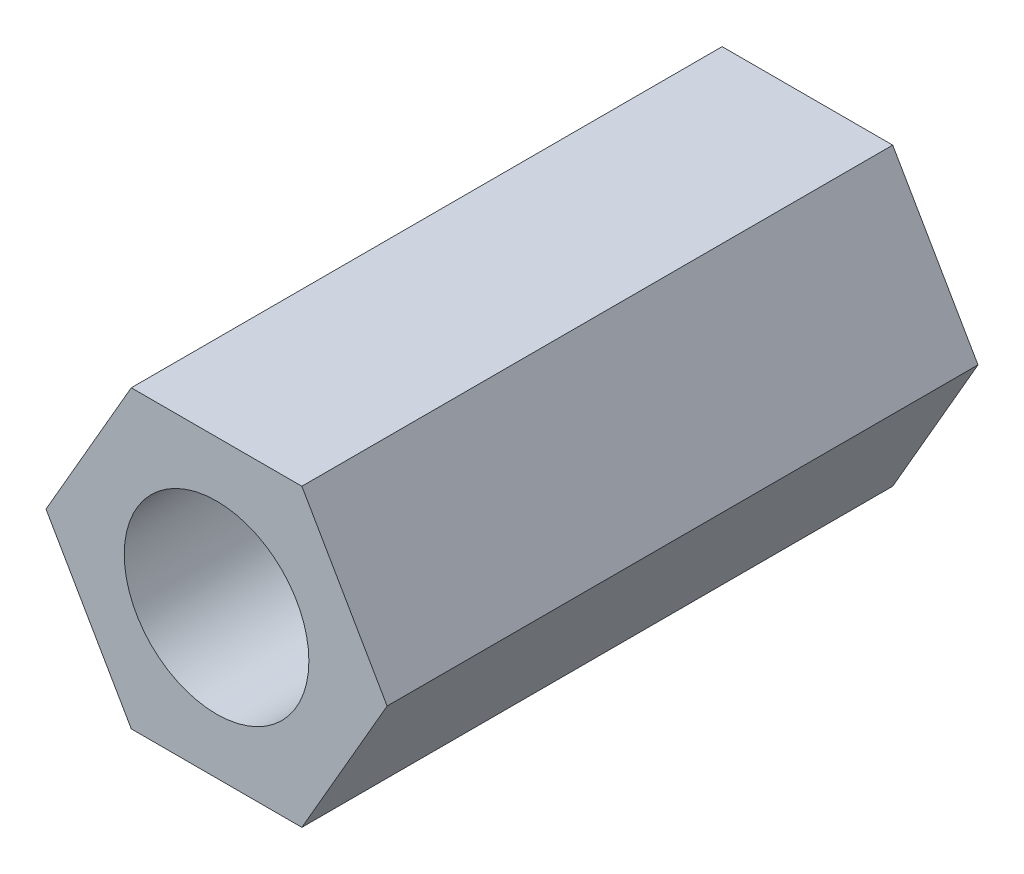
from build123d import *

# Parameters (mm, degrees)
BOSS_EXTRUDE1_DEPTH     = 8
CUT_EXTRUDE1_DEPTH      = 9.563488386
CUT_EXTRUDE1_DEPTH_BACK = 9.563488386
SKETCH2_R               = 1.25


with BuildPart() as part:
    # Sketch1 → Boss-Extrude1 (new body)
    with BuildSketch(Plane.XY):
        Polygon((2.309401077, 0), (1.154700538, 2), (-1.154700538, 2), (-2.309401077, 0), (-1.154700538, -2), (1.154700538, -2), align=None)
    extrude(amount=-BOSS_EXTRUDE1_DEPTH)

    # Sketch2 → Cut-Extrude1 (cut, two sides: drawn at the far end of the back side and taken through both)
    with BuildSketch(Plane.XY.offset(-CUT_EXTRUDE1_DEPTH_BACK)):
        Circle(SKETCH2_R)
    extrude(amount=CUT_EXTRUDE1_DEPTH + CUT_EXTRUDE1_DEPTH_BACK, mode=Mode.SUBTRACT)


solid = part.part
